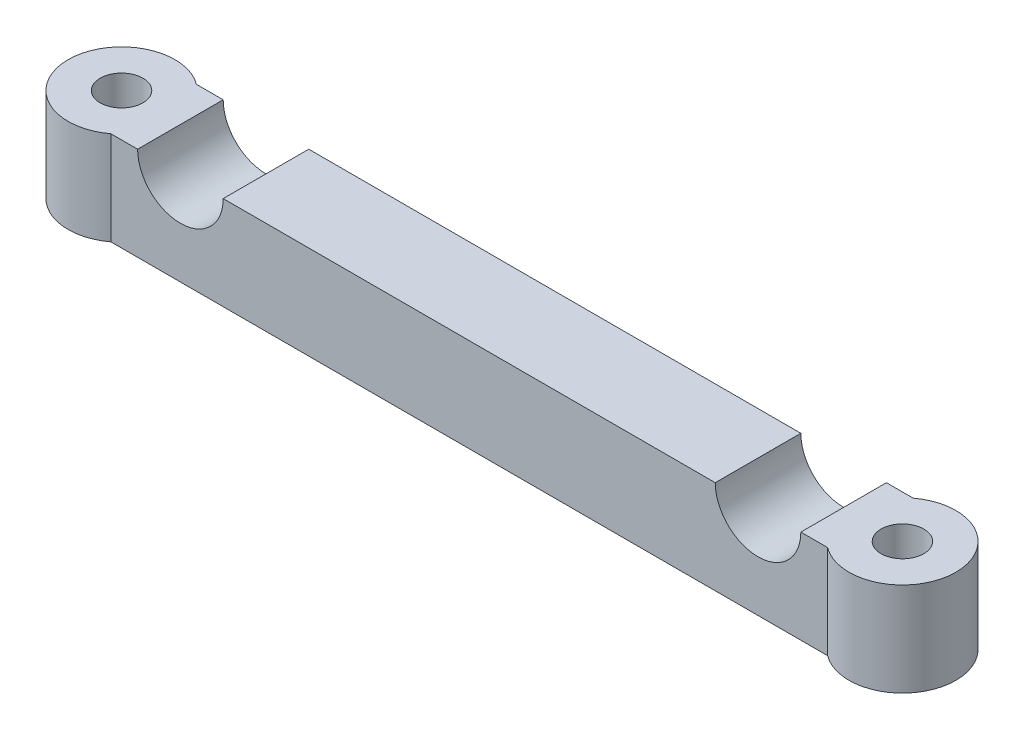
from build123d import *

# Parameters (mm, degrees)
BOSS_EXTRUDE1_DEPTH         = 13.89888
CUT_EXTRUDE1_DEPTH          = 69.830593656
CUT_EXTRUDE1_DEPTH_BACK     = 69.830593656
F_1_4_0_25_DIAMETER_HOLE1_D = 6.35


with BuildPart() as part:
    # Sketch1 → Boss-Extrude1 (new body)
    with BuildSketch(Plane(origin=(0, 0, 0), x_dir=(1, 0, 0), z_dir=(0, 1, 0))):
        with BuildLine():
            Line((-53.18125, 6.35), (53.18125, 6.35))
            ThreePointArc((53.18125, 6.35), (65.88125, 0), (53.18125, -6.35))
            Line((53.18125, -6.35), (-53.18125, -6.35))
            ThreePointArc((-53.18125, -6.35), (-65.88125, 0), (-53.18125, 6.35))
        make_face()
    extrude(amount=BOSS_EXTRUDE1_DEPTH)

    # Sketch2 → Cut-Extrude1 (cut, two sides: drawn at the far end of the back side and taken through both)
    with BuildSketch(Plane.XY.offset(6.35).offset(-CUT_EXTRUDE1_DEPTH_BACK)):
        with BuildLine():
            Line((-49.2125, 13.89888), (-36.5125, 13.89888))
            ThreePointArc((-36.5125, 13.89888), (-42.8625, 7.54888), (-49.2125, 13.89888))
        make_face()
        with BuildLine():
            Line((36.5125, 13.89888), (49.2125, 13.89888))
            ThreePointArc((49.2125, 13.89888), (42.8625, 7.54888), (36.5125, 13.89888))
        make_face()
    extrude(amount=CUT_EXTRUDE1_DEPTH + CUT_EXTRUDE1_DEPTH_BACK, mode=Mode.SUBTRACT)

    # 1/4 (0.25) Diameter Hole1 (through all)
    with Locations(Plane(origin=(0, 13.89888, 0), x_dir=(1, 0, 0), z_dir=(0, 1, 0))):
        with Locations((-57.94375, 0), (57.94375, 0)):
            Hole(F_1_4_0_25_DIAMETER_HOLE1_D / 2)


solid = part.part
